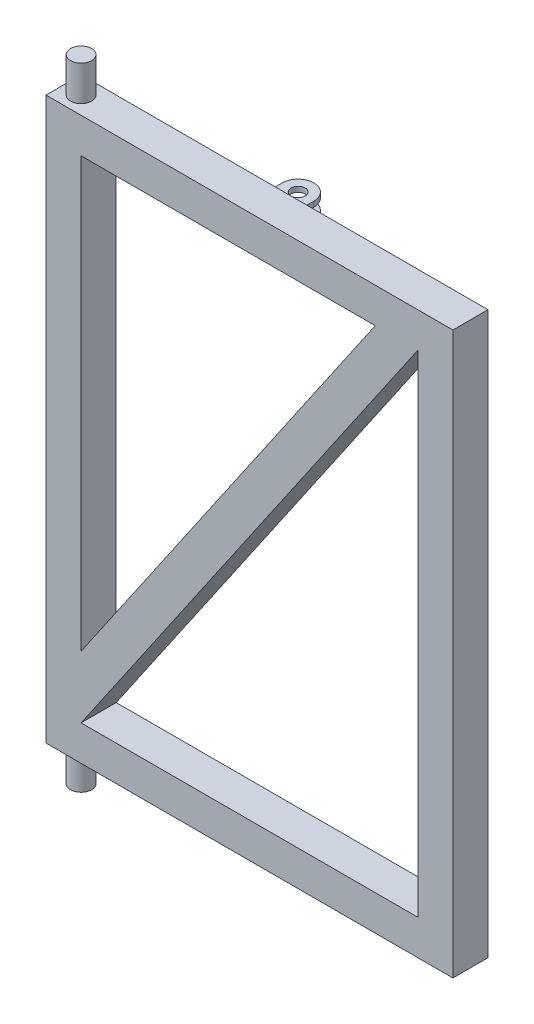
from build123d import *

# Parameters (mm, degrees)
ESQUISSE1_W             = 580
ESQUISSE1_H             = 800
BOSS_EXTRU_1_DEPTH      = 50
ESQUISSE2_R             = 15
BOSS_EXTRU_2_DEPTH      = 50
ESQUISSE3_R             = 15.180649449
BOSS_EXTRU_3_DEPTH      = 50
ESQUISSE4_R             = 10
BOSS_EXTRU_4_DEPTH      = 15
ESQUISSE5_W             = 76.670865877
ESQUISSE5_H             = 44.284034601
ENL_V_MAT_EXTRU_1_DEPTH = 7.5


with BuildPart() as part:
    # Esquisse1 → Boss.-Extru.1 (new body)
    with BuildSketch(Plane.XY):
        with Locations((290, -400)):
            Rectangle(ESQUISSE1_W, ESQUISSE1_H)
        Polygon((50, -50), (469.374013789, -50), (50, -661.587103442), align=None, mode=Mode.SUBTRACT)
        Polygon((530, -50), (530, -750), (50, -750), align=None, mode=Mode.SUBTRACT)
    extrude(amount=BOSS_EXTRU_1_DEPTH)

    # Esquisse2 → Boss.-Extru.2 (add)
    with BuildSketch(Plane(origin=(0, 0, 0), x_dir=(1, 0, 0), z_dir=(0, 1, 0))):
        with Locations(Location((25, -25, 0), (0, 0, 90))):
            Circle(ESQUISSE2_R)
    extrude(amount=BOSS_EXTRU_2_DEPTH)

    # Esquisse3 → Boss.-Extru.3 (add)
    with BuildSketch(Plane.XZ.offset(800)):
        with Locations(Location((25, 25, 0), (0, 0, 90))):
            Circle(ESQUISSE3_R)
    extrude(amount=BOSS_EXTRU_3_DEPTH)

    # Esquisse4 → Boss.-Extru.4 (add, symmetric)
    with BuildSketch(Plane(origin=(0, -25, 0), x_dir=(1, 0, 0), z_dir=(0, 1, 0))):
        with BuildLine():
            Line((311.828309325, -8.678116476), (266.828309325, -8.678116476))
            Line((266.828309325, -8.678116476), (266.828309325, 20))
            ThreePointArc((266.828309325, 20), (289.328309325, 42.5), (311.828309325, 20))
            Line((311.828309325, 20), (311.828309325, -8.678116476))
        make_face()
        with Locations(Location((289.328309325, 20, 0), (0, 0, 270))):
            Circle(ESQUISSE4_R, mode=Mode.SUBTRACT)
    extrude(amount=BOSS_EXTRU_4_DEPTH, both=True)

    # Esquisse5 → Enlèv. mat.-Extru.1 (cut, symmetric)
    with BuildSketch(Plane(origin=(0, -25, 0), x_dir=(1, 0, 0), z_dir=(0, 1, 0))):
        with Locations((288.67808852, 27.082772298)):
            Rectangle(ESQUISSE5_W, ESQUISSE5_H)
    extrude(amount=ENL_V_MAT_EXTRU_1_DEPTH, both=True, mode=Mode.SUBTRACT)


solid = part.part
